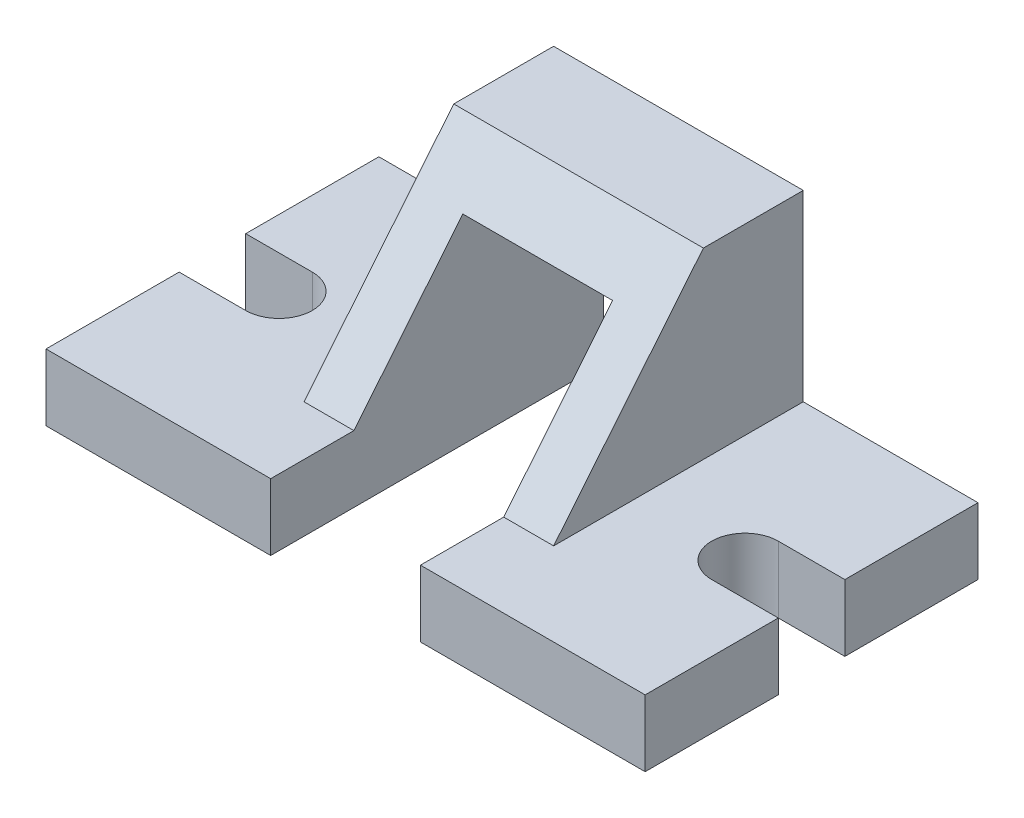
from build123d import *

# Parameters (mm, degrees)
SKETCH_1_W               = 72
SKETCH_1_H               = 40
EXTRUDE_1_DEPTH          = 8
SKETCH_2_W               = 30
SKETCH_2_H               = 40
EXTRUDE_2_DEPTH          = 30
CUT_EXTRUDE_1_DEPTH      = 30
CUT_EXTRUDE_1_DEPTH_BACK = 30
CUT_EXTRUDE_2_DEPTH      = 30
CUT_EXTRUDE_2_DEPTH_BACK = 30
SKETCH_4_W               = 18
SKETCH_4_H               = 24
CUT_EXTRUDE_4_DEPTH      = 30
CUT_EXTRUDE_4_DEPTH_BACK = 30


with BuildPart() as part:
    # 草图1 → 凸台-拉伸1 (new body)
    with BuildSketch(Plane(origin=(0, 0, 0), x_dir=(1, 0, 0), z_dir=(0, 1, 0))):
        Rectangle(SKETCH_1_W, SKETCH_1_H)
    extrude(amount=EXTRUDE_1_DEPTH)

    # 草图2 → 凸台-拉伸2 (add)
    with BuildSketch(Plane(origin=(0, 0, 0), x_dir=(1, 0, 0), z_dir=(0, 1, 0))):
        Rectangle(SKETCH_2_W, SKETCH_2_H)
    extrude(amount=EXTRUDE_2_DEPTH)

    # 草图3 → 切除-拉伸1 (cut, two sides: drawn at the far end of the back side and taken through both)
    with BuildSketch(Plane(origin=(0, 0, 0), x_dir=(0, 0, -1), z_dir=(1, 0, 0)).offset(-CUT_EXTRUDE_1_DEPTH_BACK)):
        Polygon((-9.996476923, 8), (8, 30), (-20, 30), (-20, 8), align=None)
    extrude(amount=CUT_EXTRUDE_1_DEPTH + CUT_EXTRUDE_1_DEPTH_BACK, mode=Mode.SUBTRACT)

    # 草图4 → 切除-拉伸2 (cut, two sides: drawn at the far end of the back side and taken through both)
    with BuildSketch(Plane.XY.offset(-CUT_EXTRUDE_2_DEPTH_BACK)):
        with Locations((0, 12)):
            Rectangle(SKETCH_4_W, SKETCH_4_H)
    extrude(amount=CUT_EXTRUDE_2_DEPTH + CUT_EXTRUDE_2_DEPTH_BACK, mode=Mode.SUBTRACT)

    # 草图7 → 切除-拉伸4 (cut, two sides: drawn at the far end of the back side and taken through both)
    with BuildSketch(Plane(origin=(0, 0, 0), x_dir=(1, 0, 0), z_dir=(0, 1, 0)).offset(-CUT_EXTRUDE_4_DEPTH_BACK)):
        with BuildLine():
            Line((-28, 4), (-36, 4))
            Line((-36, 4), (-36, -4))
            Line((-36, -4), (-28, -4))
            ThreePointArc((-28, -4), (-24, 0), (-28, 4))
        make_face()
        with BuildLine():
            Line((28, 4), (36, 4))
            Line((36, 4), (36, -4))
            Line((36, -4), (28, -4))
            ThreePointArc((28, -4), (24, 0), (28, 4))
        make_face()
    extrude(amount=CUT_EXTRUDE_4_DEPTH + CUT_EXTRUDE_4_DEPTH_BACK, mode=Mode.SUBTRACT)


solid = part.part
